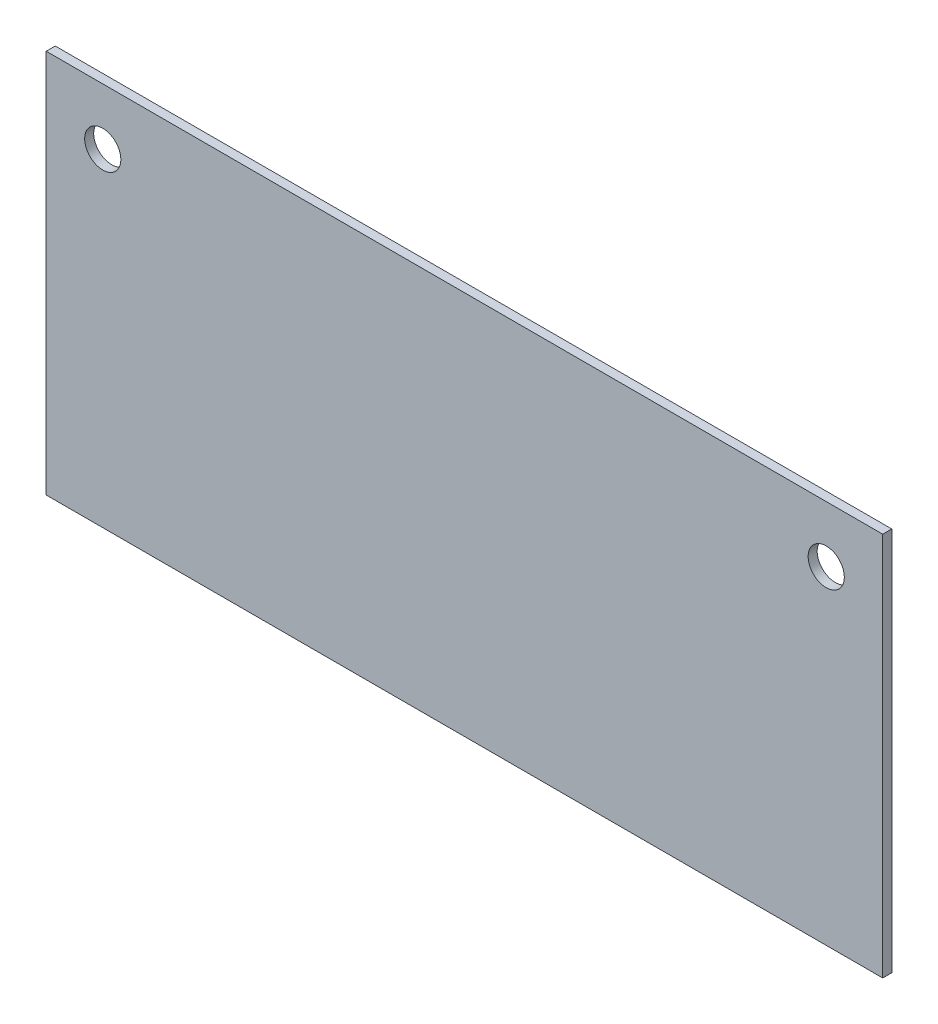
from build123d import *

# Parameters (mm, degrees)
SKETCH1_W           = 74
SKETCH1_H           = 34
SKETCH1_R           = 1.6
BOSS_EXTRUDE1_DEPTH = 0.8


with BuildPart() as part:
    # Sketch1 → Boss-Extrude1 (new body)
    with BuildSketch(Plane.XY):
        with Locations((-7.701998231, 24.438176522)):
            Rectangle(SKETCH1_W, SKETCH1_H)
        with Locations((-39.701998231, 36.438176522)):
            Circle(SKETCH1_R, mode=Mode.SUBTRACT)
        with Locations((24.298001769, 36.438176522)):
            Circle(SKETCH1_R, mode=Mode.SUBTRACT)
    extrude(amount=BOSS_EXTRUDE1_DEPTH)


solid = part.part
